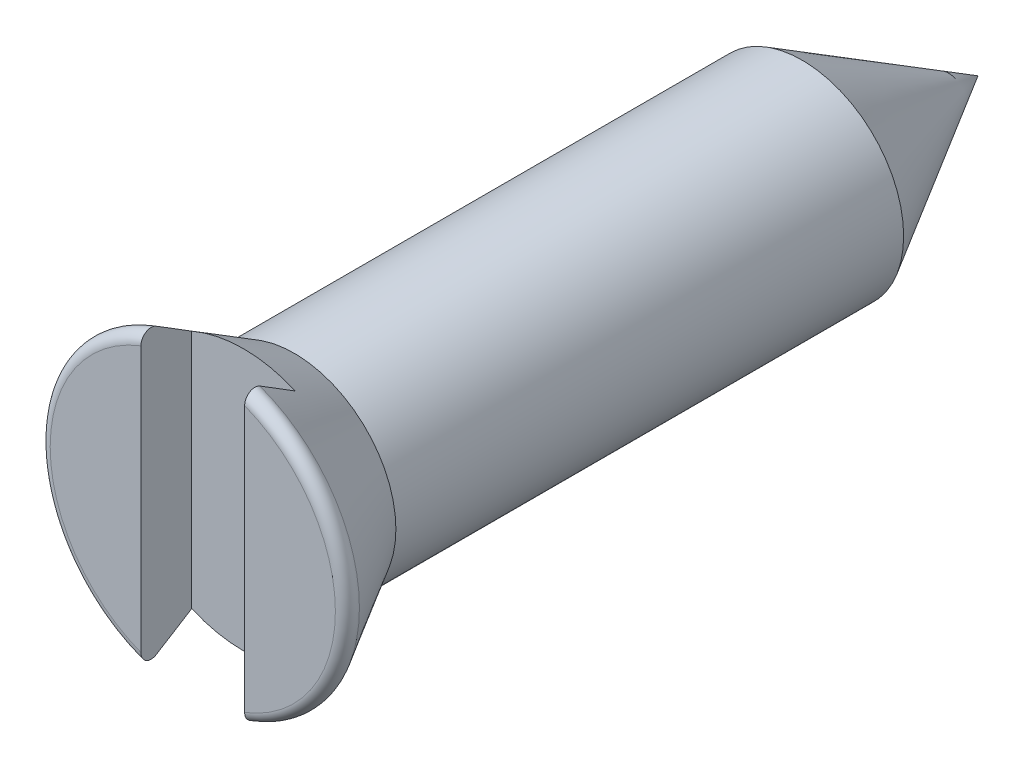
from build123d import *

# Parameters (mm, degrees)
SKETCH1_R           = 1
BOSS_EXTRUDE1_DEPTH = 5
SKETCH2_R           = 1
BOSS_EXTRUDE3_DEPTH = 1
BOSS_EXTRUDE3_DRAFT = -30
CUT_EXTRUDE1_DEPTH  = 0.5
FILLET2_R           = 0.1


with BuildPart() as part:
    # Sketch1 → Boss-Extrude1 (new body)
    with BuildSketch(Plane.XY):
        Circle(SKETCH1_R)
    extrude(amount=BOSS_EXTRUDE1_DEPTH)

    # Boss-Extrude2 cone 1 section (through the dimple's axis) → Boss-Extrude2 (revolve)
    with BuildSketch(Plane(origin=(0, 0, 0), x_dir=(0, -1, 0), z_dir=(1, 0, 0))):
        Polygon((0, 0), (1, 0), (0, 1.732050808), align=None)
    revolve(axis=Axis((0, 0, 0), (0, 0, -1)))


with BuildPart() as boss_extrude3_tool:
    # Sketch2 → Boss-Extrude3 (with draft: the straight prism first)
    with BuildSketch(Plane.XY.offset(5)):
        Circle(SKETCH2_R)
    extrude(amount=BOSS_EXTRUDE3_DEPTH)
    # Boss-Extrude3: the draft: its side faces are tilted about the plane it starts from
    boss_extrude3_sides = [boss_extrude3_tool.faces().sort_by_distance(p)[0] for p in [
        (-1, 0, 5.5),
    ]]
    draft(boss_extrude3_sides, Plane.XY.offset(5), BOSS_EXTRUDE3_DRAFT)


with BuildPart() as part_1:
    add(part.part)

    # Boss-Extrude3: add boss_extrude3_tool
    add(boss_extrude3_tool.part)

    # Sketch3 → Cut-Extrude1 (cut)
    with BuildSketch(Plane.XY.offset(6)):
        with BuildLine():
            Line((-0.510620476, 1.492414353), (-0.510620476, -1.492414353))
            ThreePointArc((-0.510620476, -1.492414353), (0, -1.577350269), (0.510620476, -1.492414353))
            Line((0.510620476, -1.492414353), (0.510620476, 1.492414353))
            ThreePointArc((0.510620476, 1.492414353), (0, 1.577350269), (-0.510620476, 1.492414353))
        make_face()
    extrude(amount=-CUT_EXTRUDE1_DEPTH, mode=Mode.SUBTRACT)

    # Fillet2
    fillet2_edges = [part_1.edges().sort_by_distance(p)[0] for p in [
        (-1.577350269, 0, 6),
        (1.283250018, 0.917225852, 6),
    ]]
    fillet(fillet2_edges, radius=FILLET2_R)


solid = part_1.part
